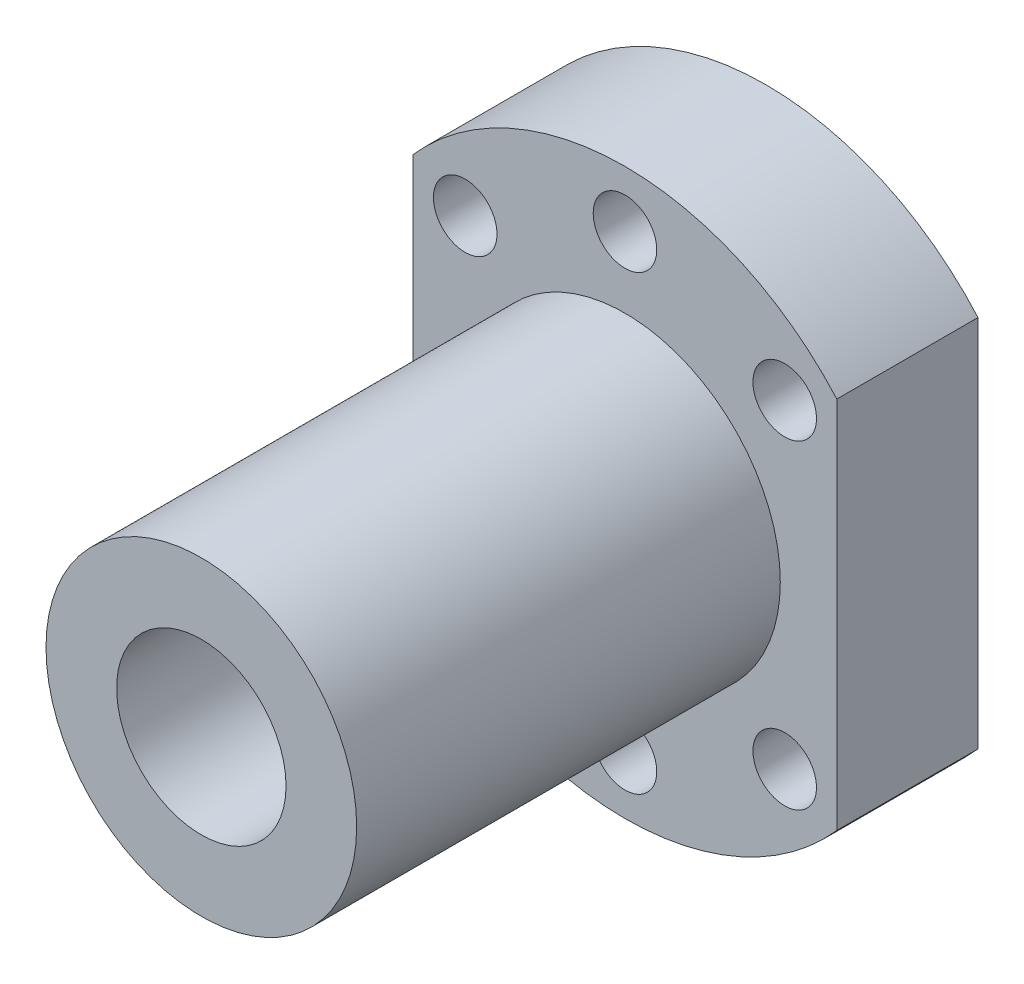
from build123d import *

# Parameters (mm, degrees)
BOSS_EXTRUDE1_DEPTH = 10
SKETCH2_R           = 11
BOSS_EXTRUDE2_DEPTH = 40
SKETCH3_R           = 6
CUT_EXTRUDE1_DEPTH  = 48.16990566
SKETCH4_R           = 2.25
CUT_EXTRUDE2_DEPTH  = 48.16990566


with BuildPart() as part:
    # Sketch1 → Boss-Extrude1 (new body)
    with BuildSketch(Plane.XY):
        with BuildLine():
            Line((-15, 13.228756555), (-15, -13.228756555))
            ThreePointArc((-15, -13.228756555), (0, -20), (15, -13.228756555))
            Line((15, -13.228756555), (15, 13.228756555))
            ThreePointArc((15, 13.228756555), (0, 20), (-15, 13.228756555))
        make_face()
    extrude(amount=BOSS_EXTRUDE1_DEPTH)

    # Sketch2 → Boss-Extrude2 (add)
    with BuildSketch(Plane(origin=(0, 0, 0), x_dir=(-1, 0, 0), z_dir=(0, 0, -1))):
        Circle(SKETCH2_R)
    extrude(amount=-BOSS_EXTRUDE2_DEPTH)

    # Sketch3 → Cut-Extrude1 (cut, through all)
    with BuildSketch(Plane.XY.offset(40)):
        Circle(SKETCH3_R)
    extrude(amount=-CUT_EXTRUDE1_DEPTH, mode=Mode.SUBTRACT)

    # Sketch4 → Cut-Extrude2 (cut, through all)
    with BuildSketch(Plane(origin=(0, 0, 0), x_dir=(-1, 0, 0), z_dir=(0, 0, -1))):
        with Locations((-11.313708499, 11.313708499)):
            Circle(SKETCH4_R)
        with Locations((0, 16)):
            Circle(SKETCH4_R)
        with Locations((11.313708499, 11.313708499)):
            Circle(SKETCH4_R)
    cut_extrude2 = extrude(amount=-CUT_EXTRUDE2_DEPTH, mode=Mode.SUBTRACT)

    # Mirror1: Cut-Extrude2 across plane
    add(cut_extrude2.mirror(Plane.ZX), mode=Mode.SUBTRACT)


solid = part.part
